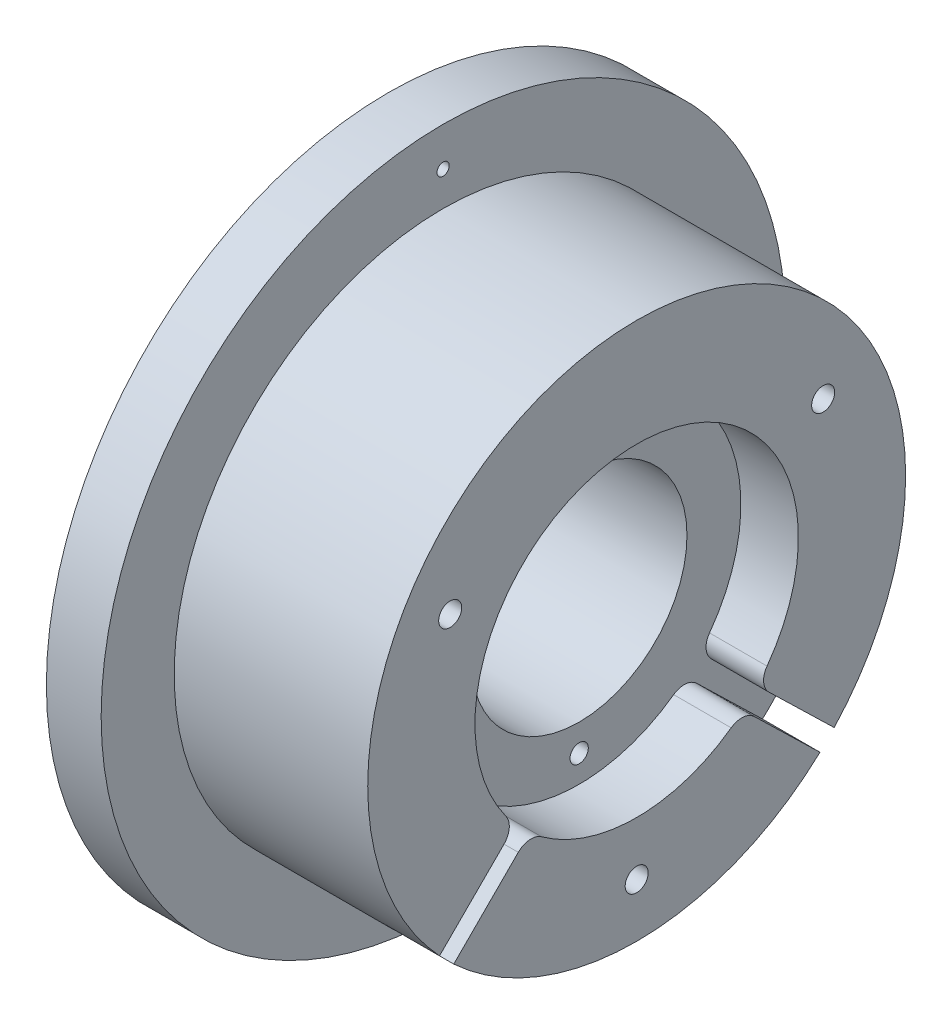
from build123d import *

# Parameters (mm, degrees)
SKETCH2_R                 = 0.315
CUT_EXTRUDE1_DEPTH        = 4
SKETCH3_R                 = 0.425
CUT_EXTRUDE2_DEPTH        = 37.233654202
SKETCH4_R                 = 0.635
CUT_EXTRUDE3_DEPTH        = 37.16349315
FILLET1_R                 = 1.25
M2X0_4_TAPPED_HOLE1_D     = 1.6
M2X0_4_TAPPED_HOLE1_DEPTH = 6.35
M2X0_4_TAPPED_HOLE1_TIP   = 0.480688495


with BuildPart() as part:
    # Sketch1 → Revolve1 (revolve)
    with BuildSketch(Plane.XY):
        Polygon((0, 23.7871), (0, 7.5), (13.272, 7.5), (13.272, 11.25), (17.272, 11.25), (17.272, 18.7071), (3.81, 18.7071), (3.81, 23.7871), align=None)
    revolve(axis=Axis((13.272, 0, 0), (-1, 0, 0)))

    # Sketch2 → Cut-Extrude1 (cut)
    with BuildSketch(Plane(origin=(17.272, 0, 0), x_dir=(0, 0, -1), z_dir=(1, 0, 0))):
        with BuildLine():
            Line((-0.657808531, -0.677910665), (0, 0))
            Line((0, 0), (-0.494974747, 0.494974747))
            Line((-0.494974747, 0.494974747), (-8.434511887, -7.444562393))
            ThreePointArc((-8.434511887, -7.444562393), (-7.954951288, -7.954951288), (-7.444562393, -8.434511887))
            Line((-7.444562393, -8.434511887), (-0.16558691, -1.155536403))
            Line((-0.16558691, -1.155536403), (-0.657808531, -0.677910665))
        make_face()
        with BuildLine():
            Line((-12.723678558, -13.713628052), (-7.444562393, -8.434511887))
            ThreePointArc((-7.444562393, -8.434511887), (-7.954951288, -7.954951288), (-8.434511887, -7.444562393))
            Line((-8.434511887, -7.444562393), (-13.713628052, -12.723678558))
            ThreePointArc((-13.713628052, -12.723678558), (-13.473131789, -12.978070358), (-13.227917265, -13.227917267))
            ThreePointArc((-13.227917265, -13.227917267), (-12.978070357, -13.473131789), (-12.723678558, -13.713628052))
        make_face()
        with BuildLine():
            Line((13.738626304, -12.696682153), (8.384270986, -7.501099921))
            ThreePointArc((8.384270986, -7.501099921), (7.901171337, -8.00837009), (7.387437256, -8.484590196))
            Line((7.387437256, -8.484590196), (12.750537979, -13.688658505))
            ThreePointArc((12.750537979, -13.688658505), (13.09218126, -13.362274517), (13.425472665, -13.027366354))
            ThreePointArc((13.425472665, -13.027366354), (13.58305585, -12.862977268), (13.738626304, -12.696682153))
        make_face()
        with BuildLine():
            Line((8.384270986, -7.501099921), (0.317132147, 0.326823466))
            Line((0.317132147, 0.326823466), (0, 0))
            Line((0, 0), (0.494974747, -0.494974747))
            Line((0.494974747, -0.494974747), (-0.16558691, -1.155536403))
            Line((-0.16558691, -1.155536403), (7.387437256, -8.484590196))
            ThreePointArc((7.387437256, -8.484590196), (7.901171337, -8.00837009), (8.384270986, -7.501099921))
        make_face()
        with Locations((0, -14.9775)):
            Circle(SKETCH2_R)
        with Locations((-12.970895485, 7.48875)):
            Circle(SKETCH2_R)
        with Locations((12.970895485, 7.48875)):
            Circle(SKETCH2_R)
    extrude(amount=-CUT_EXTRUDE1_DEPTH, mode=Mode.SUBTRACT)

    # Sketch3 → Cut-Extrude2 (cut, through all)
    with BuildSketch(Plane(origin=(3.81, 0, 0), x_dir=(0, 0, -1), z_dir=(1, 0, 0))):
        with Locations(Location((0, 21.082, 0), (0, 0, 90))):
            Circle(SKETCH3_R)
    extrude(amount=-CUT_EXTRUDE2_DEPTH, mode=Mode.SUBTRACT)

    # Sketch4 → Cut-Extrude3 (cut, through all)
    with BuildSketch(Plane(origin=(13.272, 0, 0), x_dir=(0, 0, -1), z_dir=(1, 0, 0))):
        with Locations(Location((0, 9.375, 0), (0, 0, 90))):
            Circle(SKETCH4_R)
        with Locations(Location((0, -9.375, 0), (0, 0, 90))):
            Circle(SKETCH4_R)
    extrude(amount=-CUT_EXTRUDE3_DEPTH, mode=Mode.SUBTRACT)

    # Fillet1
    fillet1_edges = [part.edges().sort_by_distance(p)[0] for p in [
        (15.272, -7.444562393, 8.434511887),
        (15.272, -8.434511887, 7.444562393),
        (15.272, -7.501099921, -8.384270986),
        (15.272, -8.484590196, -7.387437256),
    ]]
    fillet(fillet1_edges, radius=FILLET1_R)

    # M2x0.4 Tapped Hole1
    with Locations(Plane(origin=(17.272, 7.48875, 12.970895485), x_dir=(0, 0, 1), z_dir=(1, 0, 0))):
        with Locations((0, 0), (-25.94179097, 0), (-12.970895485, 22.46625)):
            Hole(M2X0_4_TAPPED_HOLE1_D / 2, depth=M2X0_4_TAPPED_HOLE1_DEPTH)
            with Locations((0, 0, -(M2X0_4_TAPPED_HOLE1_DEPTH + M2X0_4_TAPPED_HOLE1_TIP / 2))):  # 118° drill point
                Cone(0, M2X0_4_TAPPED_HOLE1_D / 2, M2X0_4_TAPPED_HOLE1_TIP, mode=Mode.SUBTRACT)


solid = part.part
